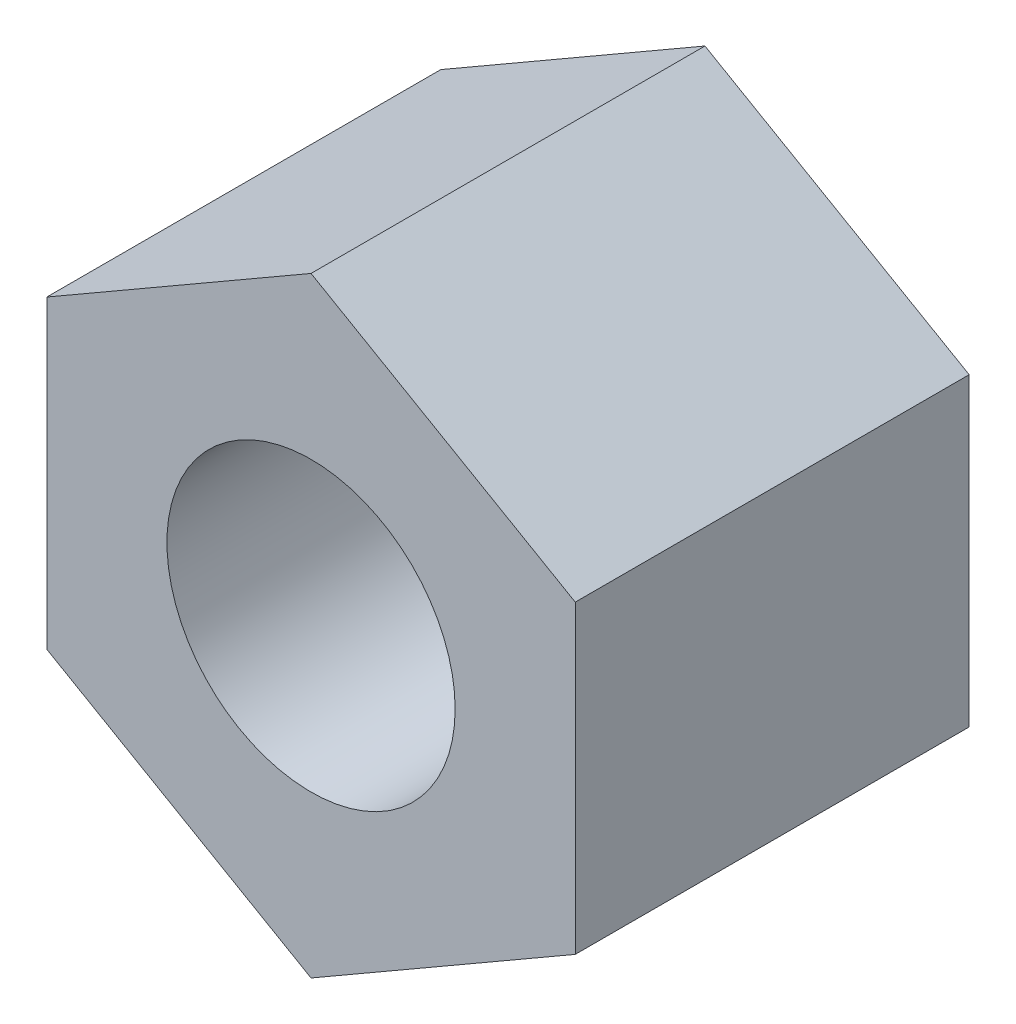
from build123d import *

# Parameters (mm, degrees)
SKETCH_1_R      = 1.5
EXTRUDE_1_DEPTH = 4.1


with BuildPart() as part:
    # Эскиз1 → Бобышка-Вытянуть1 (new body)
    with BuildSketch(Plane.XY):
        Polygon((2.75, 1.58771324), (0, 3.175426481), (-2.75, 1.58771324), (-2.75, -1.58771324), (0, -3.175426481), (2.75, -1.58771324), align=None)
        Circle(SKETCH_1_R, mode=Mode.SUBTRACT)
    extrude(amount=EXTRUDE_1_DEPTH)


solid = part.part
